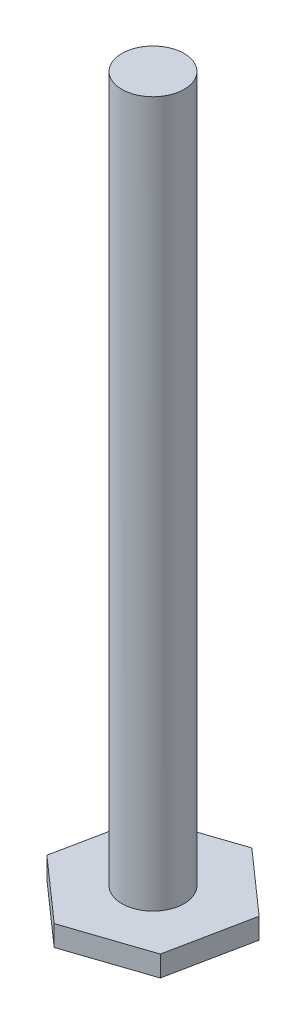
from build123d import *

# Parameters (mm, degrees)
SKETCH1_W           = 1.5
SKETCH1_H           = 35
BOSS_EXTRUDE1_DEPTH = 1


with BuildPart() as part:
    # Sketch1 → Revolve1 (revolve)
    with BuildSketch(Plane.XY, mode=Mode.PRIVATE) as revolve1_sk:
        with Locations((0.75, 17.5)):
            Rectangle(SKETCH1_W, SKETCH1_H)
    revolve(revolve1_sk.sketch.rotate(Axis((0, 0, 0), (0, 1, 0)), 90), axis=Axis((0, 0, 0), (0, 1, 0)))

    # Sketch2 → Boss-Extrude1 (add)
    with BuildSketch(Plane(origin=(0, 0, 0), x_dir=(1, 0, 0), z_dir=(0, 1, 0))):
        Polygon((3.831715084, 1.2850264), (0.802992035, 3.960875803), (-3.028723049, 2.675849403), (-3.831715084, -1.2850264), (-0.802992035, -3.960875803), (3.028723049, -2.675849403), align=None)
    extrude(amount=BOSS_EXTRUDE1_DEPTH)


solid = part.part
